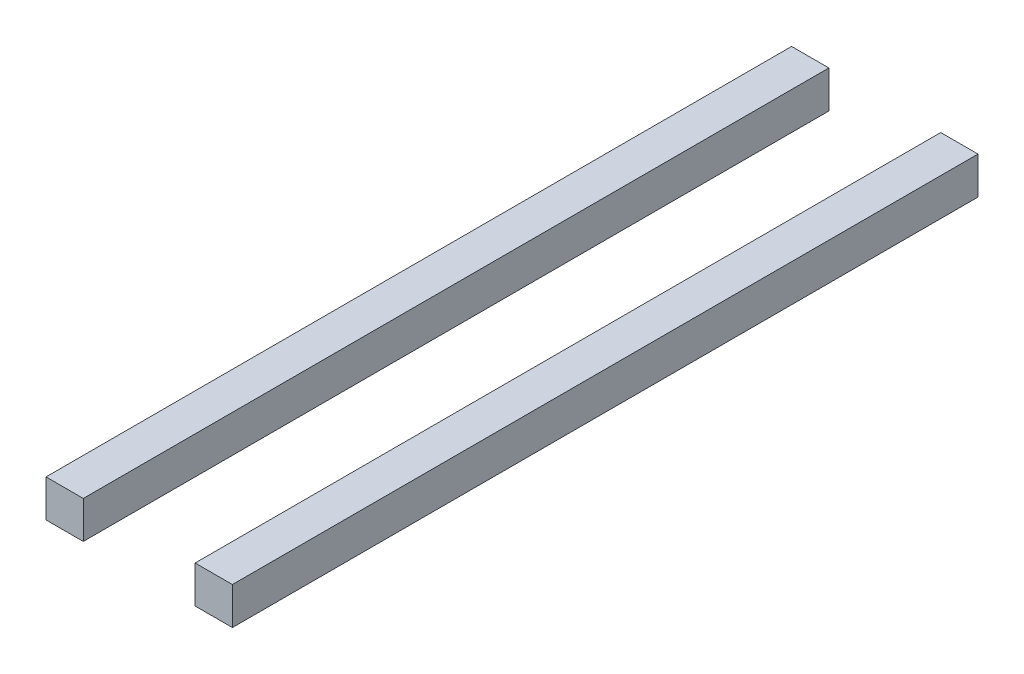
from build123d import *

# Parameters (mm, degrees)
SKETCH_1_W        = 20
SKETCH_1_H        = 20
EXTRUDE_1_DEPTH   = 400
EXTRUDE_1_2_DEPTH = 400


with BuildPart() as part:
    # 草图1 → 凸台-拉伸1 (new body)
    with BuildSketch(Plane.XY):
        with Locations((40, -10)):
            Rectangle(SKETCH_1_W, SKETCH_1_H)
    extrude(amount=-EXTRUDE_1_DEPTH)


with BuildPart() as body_2:
    # 草图1 → Extrude 1 2 (new body)
    with BuildSketch(Plane.XY):
        with Locations((-40, -10)):
            Rectangle(SKETCH_1_W, SKETCH_1_H)
    extrude(amount=-EXTRUDE_1_2_DEPTH)


solid = Compound([part.part, body_2.part])
